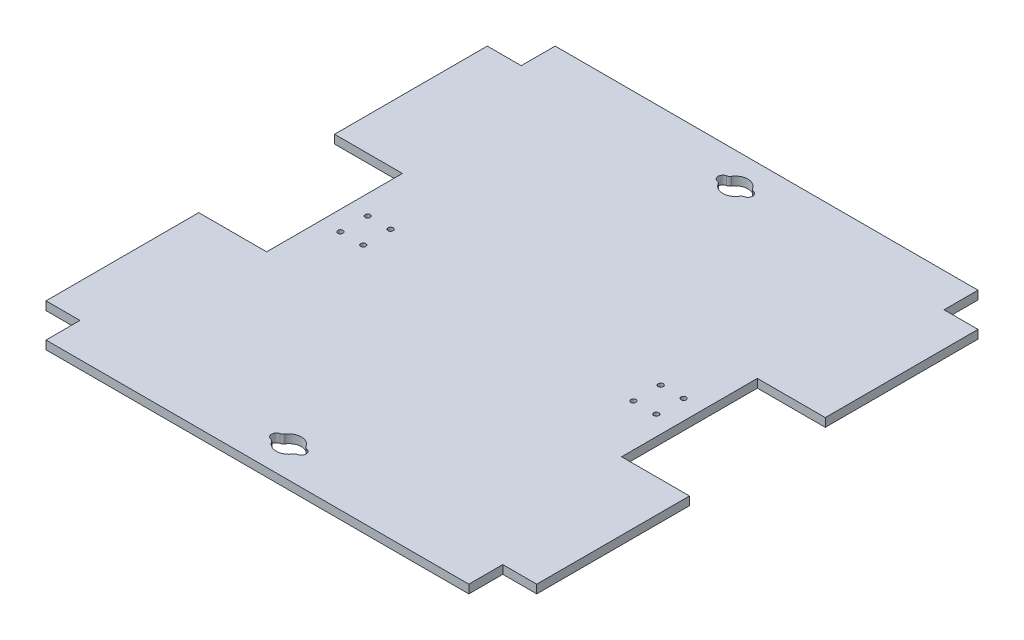
from build123d import *

# Parameters (mm, degrees)
BOSS_EXTRU_1_DEPTH      = 5
ESQUISSE2_R             = 1.5
ENL_V_MAT_EXTRU_1_DEPTH = 10


with BuildPart() as part:
    # Esquisse1 → Boss.-Extru.1 (new body)
    with BuildSketch(Plane(origin=(0, 0, 0), x_dir=(1, 0, 0), z_dir=(0, 1, 0))):
        Polygon((-124.568322948, 150), (-124.568322948, 130), (-144.568322948, 130), (-144.568322948, 40), (-104.568322948, 40), (-104.568322948, -40), (-144.568322948, -40), (-144.568322948, -130), (-124.568322948, -130), (-124.568322948, -150), (124.568322948, -150), (124.568322948, -130), (144.568322948, -130), (144.568322948, -40), (104.568322948, -40), (104.568322948, 40), (144.568322948, 40), (144.568322948, 130), (124.568322948, 130), (124.568322948, 150), align=None)
    extrude(amount=BOSS_EXTRU_1_DEPTH)

    # Esquisse2 → Enlèv. mat.-Extru.1 (cut)
    with BuildSketch(Plane(origin=(0, 5, 0), x_dir=(1, 0, 0), z_dir=(0, 1, 0))):
        with Locations(Location((-93.068322948, 8.042853971, 0), (0, 0, 270))):
            Circle(ESQUISSE2_R)
        with Locations(Location((-93.068322948, -8.042853971, 0), (0, 0, 270))):
            Circle(ESQUISSE2_R)
        with Locations(Location((-79.568322948, -8.042853971, 0), (0, 0, 270))):
            Circle(ESQUISSE2_R)
        with Locations(Location((-79.568322948, 8.042853971, 0), (0, 0, 270))):
            Circle(ESQUISSE2_R)
        with Locations(Location((93.068322948, -8.042853971, 0), (0, 0, 270))):
            Circle(ESQUISSE2_R)
        with Locations(Location((79.568322948, -8.042853971, 0), (0, 0, 270))):
            Circle(ESQUISSE2_R)
        with Locations(Location((79.568322948, 8.042853971, 0), (0, 0, 270))):
            Circle(ESQUISSE2_R)
        with Locations(Location((93.068322948, 8.042853971, 0), (0, 0, 270))):
            Circle(ESQUISSE2_R)
        with BuildLine():
            ThreePointArc((7.970010145, -128.811194391), (7.021605285, -128.408236457), (6.3113263, -127.661677259))
            ThreePointArc((6.3113263, -127.661677259), (0.055762197, -124.184876889), (-6.199801905, -127.661677259))
            ThreePointArc((-6.199801905, -127.661677259), (-6.910080891, -128.408236457), (-7.85848575, -128.811194391))
            ThreePointArc((-7.85848575, -128.811194391), (-10.104237803, -131.550876889), (-7.85848575, -134.290559386))
            ThreePointArc((-7.85848575, -134.290559386), (-6.910080891, -134.69351732), (-6.199801905, -135.440076518))
            ThreePointArc((-6.199801905, -135.440076518), (0.055762197, -138.916876889), (6.3113263, -135.440076518))
            ThreePointArc((6.3113263, -135.440076518), (7.021605285, -134.69351732), (7.970010145, -134.290559386))
            ThreePointArc((7.970010145, -134.290559386), (10.215762197, -131.550876889), (7.970010145, -128.811194391))
        make_face()
        with BuildLine():
            ThreePointArc((7.970010145, 128.811194391), (10.215762197, 131.550876889), (7.970010145, 134.290559386))
            ThreePointArc((7.970010145, 134.290559386), (7.021605285, 134.69351732), (6.3113263, 135.440076518))
            ThreePointArc((6.3113263, 135.440076518), (0.055762197, 138.916876889), (-6.199801905, 135.440076518))
            ThreePointArc((-6.199801905, 135.440076518), (-6.910080891, 134.69351732), (-7.85848575, 134.290559386))
            ThreePointArc((-7.85848575, 134.290559386), (-10.104237803, 131.550876889), (-7.85848575, 128.811194391))
            ThreePointArc((-7.85848575, 128.811194391), (-6.910080891, 128.408236457), (-6.199801905, 127.661677259))
            ThreePointArc((-6.199801905, 127.661677259), (0.055762197, 124.184876889), (6.3113263, 127.661677259))
            ThreePointArc((6.3113263, 127.661677259), (7.021605285, 128.408236457), (7.970010145, 128.811194391))
        make_face()
    extrude(amount=-ENL_V_MAT_EXTRU_1_DEPTH, mode=Mode.SUBTRACT)


solid = part.part
